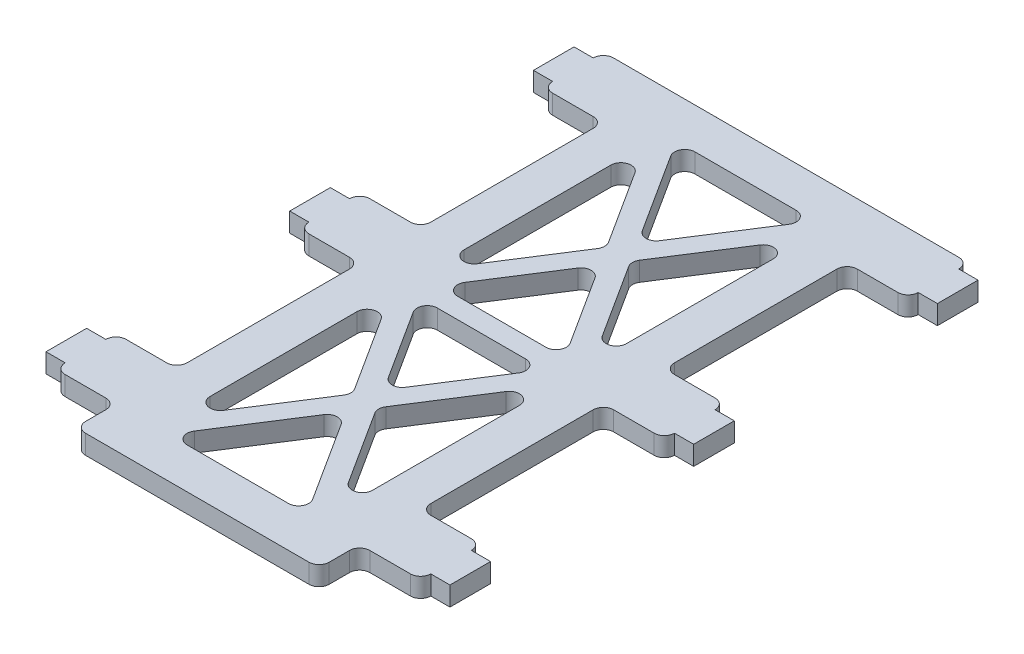
from build123d import *

# Parameters (mm, degrees)
SKETCH1_W           = 38.1
SKETCH1_H           = 92.075
BOSS_EXTRUDE1_DEPTH = 1.5
SKETCH2_W           = 9.525
SKETCH2_H           = 9.525
BOSS_EXTRUDE2_DEPTH = 3
CUT_EXTRUDE1_DEPTH  = 3
FILLET1_R           = 1.5875
SKETCH5_W           = 3
SKETCH5_H           = 6.35
BOSS_EXTRUDE3_DEPTH = 3


with BuildPart() as part:
    # Sketch1 → Boss-Extrude1 (new, symmetric)
    with BuildSketch(Plane(origin=(0, 34.29, 0), x_dir=(1, 0, 0), z_dir=(0, 1, 0))):
        with Locations((0, 120.65)):
            Rectangle(SKETCH1_W, SKETCH1_H)
    extrude(amount=BOSS_EXTRUDE1_DEPTH, both=True)

    # Sketch2 → Boss-Extrude2 (add)
    with BuildSketch(Plane(origin=(0, 35.79, 0), x_dir=(1, 0, 0), z_dir=(0, 1, 0))):
        with Locations((23.8125, 161.925)):
            Rectangle(SKETCH2_W, SKETCH2_H)
        with Locations((-23.8125, 161.925)):
            Rectangle(SKETCH2_W, SKETCH2_H)
        with Locations((23.8125, 123.825)):
            Rectangle(SKETCH2_W, SKETCH2_H)
        with Locations((-23.8125, 123.825)):
            Rectangle(SKETCH2_W, SKETCH2_H)
        with Locations((23.8125, 85.725)):
            Rectangle(SKETCH2_W, SKETCH2_H)
        with Locations((-23.8125, 85.725)):
            Rectangle(SKETCH2_W, SKETCH2_H)
    extrude(amount=-BOSS_EXTRUDE2_DEPTH)

    # Sketch4 → Cut-Extrude1 (cut)
    with BuildSketch(Plane(origin=(0, 35.79, 0), x_dir=(1, 0, 0), z_dir=(0, 1, 0))):
        Polygon((10.815215596, 160.3375), (-10.815215596, 160.3375), (0, 143.438725631), align=None)
        Polygon((-1.884784404, 140.49375), (-12.7, 157.392524369), (-12.7, 123.594975631), align=None)
        Polygon((12.7, 157.392524369), (1.884784404, 140.49375), (12.7, 123.594975631), align=None)
        Polygon((9.799215596, 122.2375), (0, 137.548774369), (-9.799215596, 122.2375), align=None)
        Polygon((-1.884784404, 100.80625), (-12.7, 117.705024369), (-12.7, 83.907475631), align=None)
        Polygon((9.799215596, 119.0625), (-9.799215596, 119.0625), (0, 103.751225631), align=None)
        Polygon((12.7, 83.907475631), (12.7, 117.705024369), (1.884784404, 100.80625), align=None)
        Polygon((10.815215596, 80.9625), (0, 97.861274369), (-10.815215596, 80.9625), align=None)
    extrude(amount=-CUT_EXTRUDE1_DEPTH, mode=Mode.SUBTRACT)

    # Fillet1
    fillet1_edges = [part.edges().sort_by_distance(p)[0] for p in [
        (9.799215596, 34.29, -122.2375),
        (-9.799215596, 34.29, -122.2375),
        (0, 34.29, -137.548774369),
        (9.799215596, 34.29, -119.0625),
        (0, 34.29, -103.751225631),
        (-9.799215596, 34.29, -119.0625),
        (10.815215596, 34.29, -80.9625),
        (-10.815215596, 34.29, -80.9625),
        (0, 34.29, -97.861274369),
        (-1.884784404, 34.29, -100.80625),
        (-12.7, 34.29, -83.907475631),
        (-12.7, 34.29, -117.705024369),
        (-1.884784404, 34.29, -140.49375),
        (-12.7, 34.29, -123.594975631),
        (-12.7, 34.29, -157.392524369),
        (12.7, 34.29, -123.594975631),
        (1.884784404, 34.29, -140.49375),
        (12.7, 34.29, -157.392524369),
        (0, 34.29, -143.438725631),
        (-10.815215596, 34.29, -160.3375),
        (10.815215596, 34.29, -160.3375),
        (12.7, 34.29, -117.705024369),
        (12.7, 34.29, -83.907475631),
        (1.884784404, 34.29, -100.80625),
        (28.575, 34.29, -80.9625),
        (28.575, 34.29, -90.4875),
        (19.05, 34.29, -90.4875),
        (19.05, 34.29, -80.9625),
        (-19.05, 34.29, -119.0625),
        (-19.05, 34.29, -128.5875),
        (-28.575, 34.29, -128.5875),
        (-28.575, 34.29, -119.0625),
        (28.575, 34.29, -119.0625),
        (28.575, 34.29, -128.5875),
        (19.05, 34.29, -128.5875),
        (19.05, 34.29, -119.0625),
        (-19.05, 34.29, -157.1625),
        (-28.575, 34.29, -166.6875),
        (-28.575, 34.29, -157.1625),
        (-19.05, 34.29, -80.9625),
        (-19.05, 34.29, -90.4875),
        (-28.575, 34.29, -90.4875),
        (-28.575, 34.29, -80.9625),
        (28.575, 34.29, -157.1625),
        (28.575, 34.29, -166.6875),
        (19.05, 34.29, -157.1625),
        (-19.05, 34.29, -74.6125),
        (19.05, 34.29, -74.6125),
    ]]
    fillet(fillet1_edges, radius=FILLET1_R)

    # Sketch5 → Boss-Extrude3 (add)
    with BuildSketch(Plane(origin=(0, 35.79, 0), x_dir=(1, 0, 0), z_dir=(0, 1, 0))):
        with Locations((30.075, 161.925)):
            Rectangle(SKETCH5_W, SKETCH5_H)
        with Locations((-30.075, 161.925)):
            Rectangle(SKETCH5_W, SKETCH5_H)
        with Locations((30.075, 123.825)):
            Rectangle(SKETCH5_W, SKETCH5_H)
        with Locations((-30.075, 123.825)):
            Rectangle(SKETCH5_W, SKETCH5_H)
        with Locations((30.075, 85.725)):
            Rectangle(SKETCH5_W, SKETCH5_H)
        with Locations((-30.075, 85.725)):
            Rectangle(SKETCH5_W, SKETCH5_H)
    extrude(amount=-BOSS_EXTRUDE3_DEPTH)


solid = part.part
